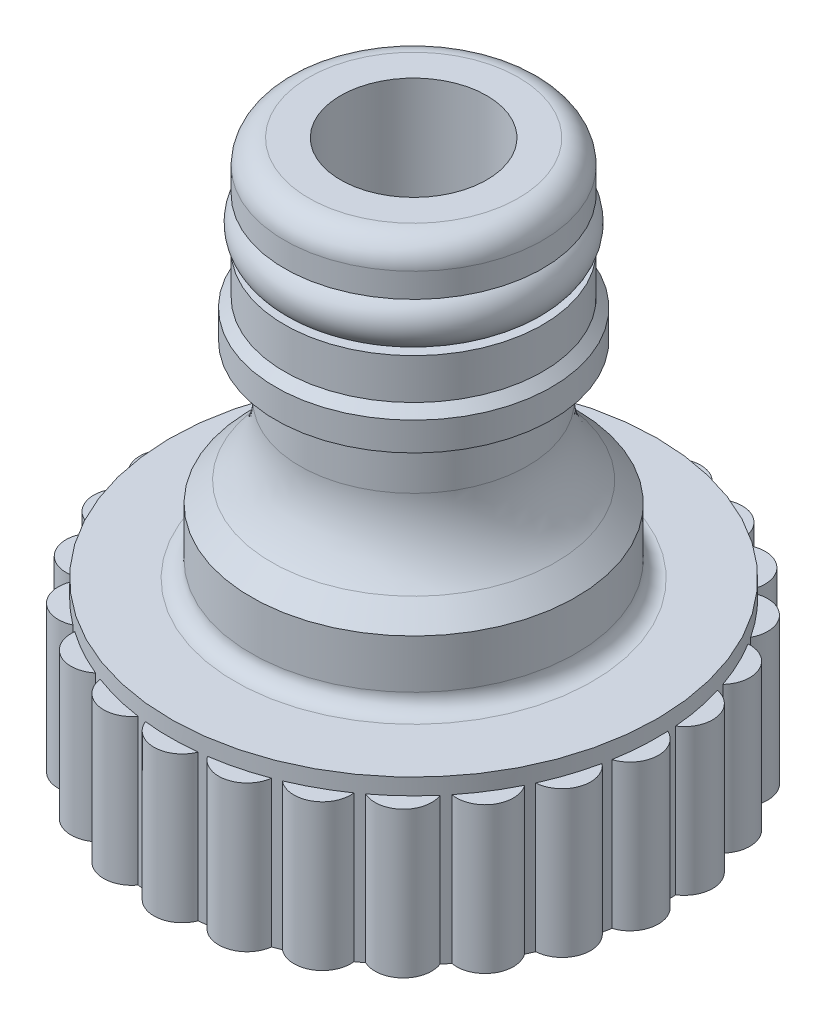
from build123d import *

# Parameters (mm, degrees)
SKETCH4_R           = 14.980406648
BOSS_EXTRUDE1_DEPTH = 10
SKETCH5_R           = 1.746619854
BOSS_EXTRUDE2_DEPTH = 9
SKETCH6_R           = 12.356257733
CUT_EXTRUDE1_DEPTH  = 10
CUT_EXTRUDE1_DRAFT  = -27.651299327
FILLET3_R           = 1
SKETCH7_R           = 1.6


with BuildPart() as part:
    # Sketch1 → Revolve1 (revolve)
    with BuildSketch(Plane.XY, mode=Mode.PRIVATE) as revolve1_sk:
        with BuildLine():
            Line((0, 23.5), (6.45, 23.5))
            ThreePointArc((6.45, 23.5), (7.510660172, 23.060660172), (7.95, 22))
            Line((7.95, 22), (7.95, 15))
            Line((7.95, 15), (8.5, 14.45))
            Line((8.5, 14.45), (8.5, 12.7))
            Line((8.5, 12.7), (7.288690869, 12.135157276))
            ThreePointArc((7.288690869, 12.135157276), (7.078304277, 11.950653187), (7, 11.682003382))
            Line((7, 11.682003382), (7, 9.485504468))
            ThreePointArc((7, 9.485504468), (7.45661978, 7.189652614), (8.756978578, 5.24324455))
            Line((8.756978578, 5.24324455), (10, 4))
            Line((10, 4), (10, 0))
            Line((10, 0), (0, 0))
            Line((0, 0), (0, 23.5))
        make_face()
    revolve(revolve1_sk.sketch.rotate(Axis((0, 0, 0), (0, 1, 0)), 90), axis=Axis((0, 0, 0), (0, 1, 0)))

    # Sketch2 → Cut-Revolve1 (revolve, cut)
    with BuildSketch(Plane.XY, mode=Mode.PRIVATE) as cut_revolve1_sk:
        with BuildLine():
            Line((7.95, 20.5), (6.25, 20.5))
            ThreePointArc((6.25, 20.5), (5.896446609, 20.353553391), (5.75, 20))
            Line((5.75, 20), (5.75, 18))
            ThreePointArc((5.75, 18), (5.896446609, 17.646446609), (6.25, 17.5))
            Line((6.25, 17.5), (7.95, 17.5))
            Line((7.95, 17.5), (7.95, 20.5))
        make_face()
    revolve(cut_revolve1_sk.sketch.rotate(Axis((0, 0, 0), (0, 1, 0)), 90), axis=Axis((0, 0, 0), (0, 1, 0)), mode=Mode.SUBTRACT)

    # Sketch3 → Cut-Revolve2 (revolve, cut)
    with BuildSketch(Plane.XY, mode=Mode.PRIVATE) as cut_revolve2_sk:
        with BuildLine():
            Line((0, 23.5), (4.5, 23.5))
            Line((4.5, 23.5), (4.5, 12.147990443))
            ThreePointArc((4.5, 12.147990443), (5.13148093, 5.94670687), (7, 0))
            Line((7, 0), (0, 0))
            Line((0, 0), (0, 23.5))
        make_face()
    revolve(cut_revolve2_sk.sketch.rotate(Axis((0, 0, 0), (0, 1, 0)), 90), axis=Axis((0, 0, 0), (0, 1, 0)), mode=Mode.SUBTRACT)

    # Sketch4 → Boss-Extrude1 (add)
    with BuildSketch(Plane.XZ):
        with Locations(Location((0, 0, 0), (0, 0, 270))):
            Circle(SKETCH4_R)
    extrude(amount=BOSS_EXTRUDE1_DEPTH)

    # Sketch5 → Boss-Extrude2 (add)
    with BuildSketch(Plane.XZ.offset(10)):
        with Locations((0, 14.244352952)):
            Circle(SKETCH5_R)
        with Locations((3.542426528, 13.796840411)):
            Circle(SKETCH5_R)
        with Locations((6.86226937, 12.482421645)):
            Circle(SKETCH5_R)
        with Locations((9.750930589, 10.38368642)):
            Circle(SKETCH5_R)
        with Locations((12.026904978, 7.632505989)):
            Circle(SKETCH5_R)
        with Locations((13.547184696, 4.401747136)):
            Circle(SKETCH5_R)
        with Locations((14.216244976, 0.894410322)):
            Circle(SKETCH5_R)
        with Locations((13.9920463, -2.669125582)):
            Circle(SKETCH5_R)
        with Locations((12.888675896, -6.064950509)):
            Circle(SKETCH5_R)
        with Locations((10.975462585, -9.07969229)):
            Circle(SKETCH5_R)
        with Locations((8.372620594, -11.523923612)):
            Circle(SKETCH5_R)
        with Locations((5.243696059, -13.244064432)):
            Circle(SKETCH5_R)
        with Locations((1.785290816, -14.132031975)):
            Circle(SKETCH5_R)
        with Locations((-1.785290816, -14.132031975)):
            Circle(SKETCH5_R)
        with Locations((-5.243696059, -13.244064432)):
            Circle(SKETCH5_R)
        with Locations((-8.372620594, -11.523923612)):
            Circle(SKETCH5_R)
        with Locations((-10.975462585, -9.07969229)):
            Circle(SKETCH5_R)
        with Locations((-12.888675896, -6.064950509)):
            Circle(SKETCH5_R)
        with Locations((-13.9920463, -2.669125582)):
            Circle(SKETCH5_R)
        with Locations((-14.216244976, 0.894410322)):
            Circle(SKETCH5_R)
        with Locations((-13.547184696, 4.401747136)):
            Circle(SKETCH5_R)
        with Locations((-12.026904978, 7.632505989)):
            Circle(SKETCH5_R)
        with Locations((-9.750930589, 10.38368642)):
            Circle(SKETCH5_R)
        with Locations((-6.86226937, 12.482421645)):
            Circle(SKETCH5_R)
        with Locations((-3.542426528, 13.796840411)):
            Circle(SKETCH5_R)
    extrude(amount=-BOSS_EXTRUDE2_DEPTH)


with BuildPart() as cut_extrude1_tool:
    # Sketch6 → Cut-Extrude1 (with draft: the straight prism first)
    with BuildSketch(Plane.XZ.offset(10)):
        Circle(SKETCH6_R)
    extrude(amount=-CUT_EXTRUDE1_DEPTH)
    # Cut-Extrude1: the draft: its side faces are tilted about the plane it starts from
    cut_extrude1_sides = [cut_extrude1_tool.faces().sort_by_distance(p)[0] for p in [
        (-12.356257733, -5, 0),
    ]]
    draft(cut_extrude1_sides, Plane.XZ.offset(10), CUT_EXTRUDE1_DRAFT)


with BuildPart() as part_1:
    add(part.part)

    # Cut-Extrude1: cut by cut_extrude1_tool
    add(cut_extrude1_tool.part, mode=Mode.SUBTRACT)

    # Fillet3
    fillet3_edges = [part_1.edges().sort_by_distance(p)[0] for p in [
        (0, 0, 10),
    ]]
    fillet(fillet3_edges, radius=FILLET3_R)

    # Sketch7 → Revolve2 (revolve)
    with BuildSketch(Plane.XY, mode=Mode.PRIVATE) as revolve2_sk:
        with Locations((6.65, 19)):
            Circle(SKETCH7_R)
    revolve(revolve2_sk.sketch.rotate(Axis((0, 0, 0), (0, 1, 0)), 90), axis=Axis((0, 0, 0), (0, 1, 0)))


solid = part_1.part
